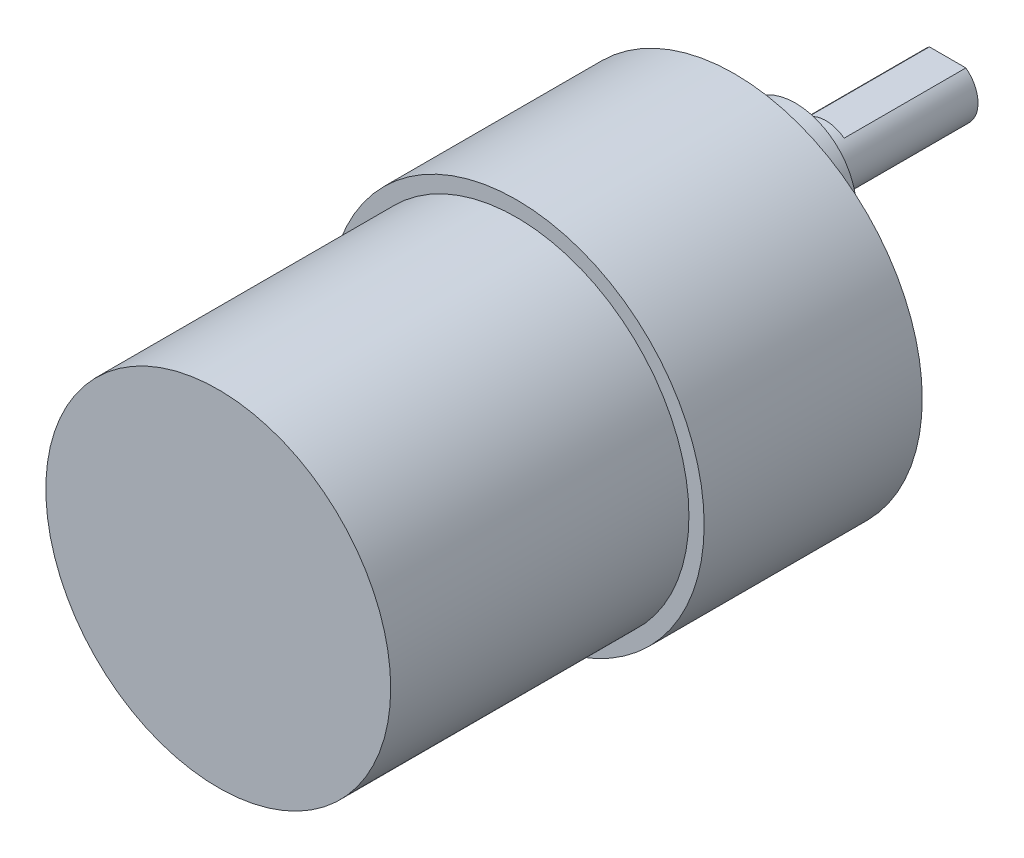
from build123d import *

# Parameters (mm, degrees)
SKETCH_1_R          = 18.5
EXTRUDE_1_DEPTH     = 21.5
SKETCH_2_R          = 17
EXTRUDE_2_DEPTH     = 29.4
CUT_EXTRUDE_1_DEPTH = 1
SKETCH_4_R          = 6
EXTRUDE_3_DEPTH     = 6
SKETCH_5_R          = 3
EXTRUDE_4_DEPTH     = 15
CUT_EXTRUDE_START   = -12
CUT_EXTRUDE_2_DEPTH = 12
SKETCH_7_R          = 1.5
CUT_EXTRUDE_3_DEPTH = 5
SKETCH_8_R          = 2
CUT_EXTRUDE_4_DEPTH = 1


with BuildPart() as part:
    # 草图1 → 凸台-拉伸1 (new body)
    with BuildSketch(Plane.XY):
        Circle(SKETCH_1_R)
    extrude(amount=EXTRUDE_1_DEPTH)

    # 草图2 → 凸台-拉伸2 (add)
    with BuildSketch(Plane.XY.offset(21.5)):
        Circle(SKETCH_2_R)
    extrude(amount=EXTRUDE_2_DEPTH)

    # 草图3 → 切除-拉伸1 (cut)
    with BuildSketch(Plane(origin=(0, 0, 0), x_dir=(-1, 0, 0), z_dir=(0, 0, -1))):
        with BuildLine():
            ThreePointArc((-11.36051163, 5.214285714), (0, -4.5), (11.36051163, 5.214285714))
            ThreePointArc((11.36051163, 5.214285714), (0, -12.5), (-11.36051163, 5.214285714))
        make_face()
    extrude(amount=-CUT_EXTRUDE_1_DEPTH, mode=Mode.SUBTRACT)

    # 草图4 → 凸台-拉伸3 (add)
    with BuildSketch(Plane(origin=(0, 0, 0), x_dir=(-1, 0, 0), z_dir=(0, 0, -1))):
        with Locations(Location((0, 7, 0), (0, 0, 180))):
            Circle(SKETCH_4_R)
    extrude(amount=EXTRUDE_3_DEPTH)

    # 草图5 → 凸台-拉伸4 (add)
    with BuildSketch(Plane(origin=(0, 0, -6), x_dir=(-1, 0, 0), z_dir=(0, 0, -1))):
        with Locations((0, 7)):
            Circle(SKETCH_5_R)
    extrude(amount=EXTRUDE_4_DEPTH)

    # 草图6 → 切除-拉伸2 (cut)
    with BuildSketch(Plane(origin=(0, 0, -21), x_dir=(-1, 0, 0), z_dir=(0, 0, -1)).offset(CUT_EXTRUDE_START)):
        with BuildLine():
            Line((0, 9.4), (1.8, 9.4))
            ThreePointArc((1.8, 9.4), (0, 10), (-1.8, 9.4))
            Line((-1.8, 9.4), (0, 9.4))
        make_face()
    extrude(amount=CUT_EXTRUDE_2_DEPTH, mode=Mode.SUBTRACT)

    # 草图7 → 切除-拉伸3 (cut)
    with BuildSketch(Plane(origin=(0, 0, 0), x_dir=(-1, 0, 0), z_dir=(0, 0, -1))):
        with Locations((15.5, 0)):
            Circle(SKETCH_7_R)
        with Locations(Location((-15.5, 0, 0), (0, 0, 180))):
            Circle(SKETCH_7_R)
        with Locations((-7.75, -13.423393759)):
            Circle(SKETCH_7_R)
        with Locations(Location((7.75, 13.423393759, 0), (0, 0, 180))):
            Circle(SKETCH_7_R)
        with Locations((-7.75, 13.423393759)):
            Circle(SKETCH_7_R)
        with Locations(Location((7.75, -13.423393759, 0), (0, 0, 180))):
            Circle(SKETCH_7_R)
    extrude(amount=-CUT_EXTRUDE_3_DEPTH, mode=Mode.SUBTRACT)

    # 草图8 → 切除-拉伸4 (cut)
    with BuildSketch(Plane(origin=(0, 0, 0), x_dir=(-1, 0, 0), z_dir=(0, 0, -1))):
        with Locations((0, -15.5)):
            Circle(SKETCH_8_R)
        with Locations((-13.423393759, 7.75)):
            Circle(SKETCH_8_R)
        with Locations((13.423393759, 7.75)):
            Circle(SKETCH_8_R)
    extrude(amount=-CUT_EXTRUDE_4_DEPTH, mode=Mode.SUBTRACT)


solid = part.part
